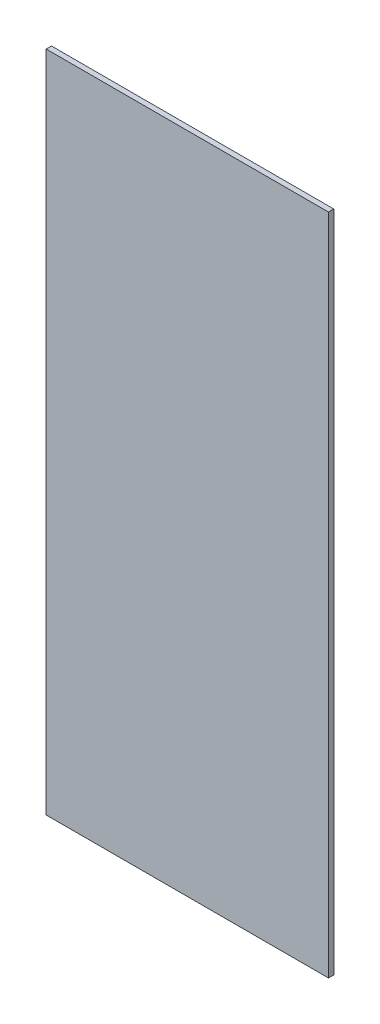
from build123d import *

# Parameters (mm, degrees)
ESQUISSE1_W        = 320
ESQUISSE1_H        = 752
BOSS_EXTRU_1_DEPTH = 6


with BuildPart() as part:
    # Esquisse1 → Boss.-Extru.1 (new body)
    with BuildSketch(Plane.XY):
        Rectangle(ESQUISSE1_W, ESQUISSE1_H)
    extrude(amount=BOSS_EXTRU_1_DEPTH)


solid = part.part
